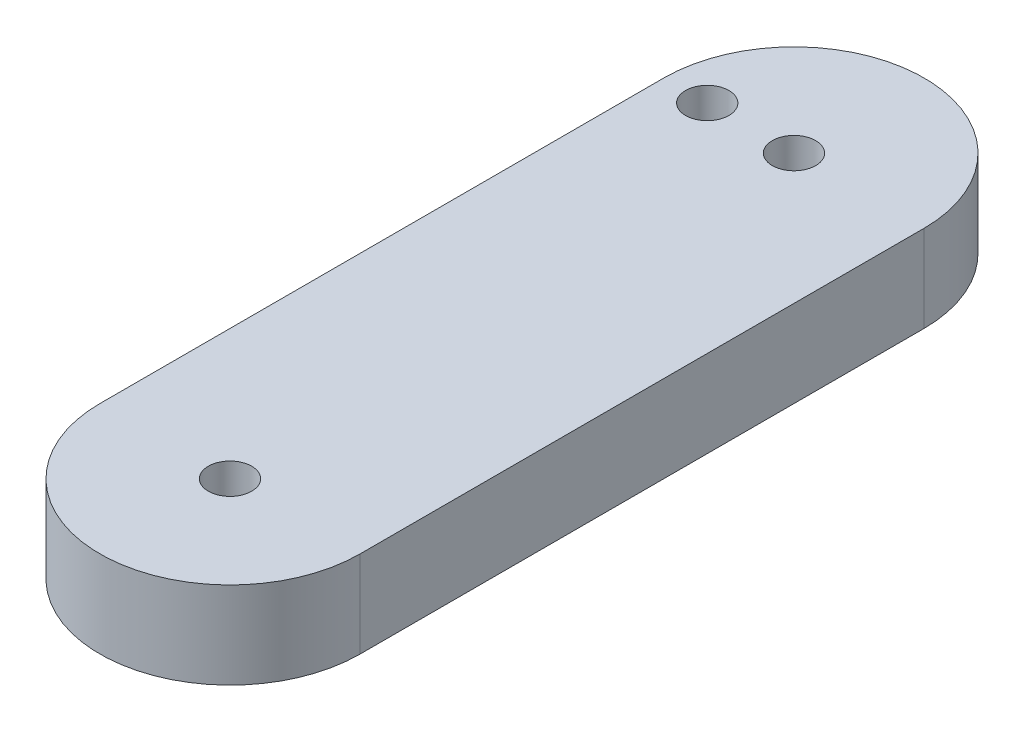
from build123d import *

# Parameters (mm, degrees)
EXTRUDE_1_DEPTH          = 10
CUT_EXTRUDE_1_DEPTH      = 87.02325267
CUT_EXTRUDE_1_DEPTH_BACK = 87.02325267
SKETCH_2_R               = 2.5
SKETCH_4_R               = 2.5
CUT_EXTRUDE_3_DEPTH      = 10


with BuildPart() as part:
    # 草图1 → 凸台-拉伸1 (new body)
    with BuildSketch(Plane(origin=(0, 0, 0), x_dir=(1, 0, 0), z_dir=(0, 1, 0))):
        with BuildLine():
            Line((0, 0), (0, 65))
            ThreePointArc((0, 65), (15, 80), (30, 65))
            Line((30, 65), (30, 0))
            ThreePointArc((30, 0), (15, -15), (0, 0))
        make_face()
    extrude(amount=EXTRUDE_1_DEPTH)

    # 草图2 → 切除-拉伸1 (cut, two sides: drawn at the far end of the back side and taken through both)
    with BuildSketch(Plane(origin=(0, 10, 0), x_dir=(1, 0, 0), z_dir=(0, 1, 0)).offset(-CUT_EXTRUDE_1_DEPTH_BACK)):
        with Locations(Location((15, 65, 0), (0, 0, 270))):
            Circle(SKETCH_2_R)
        with Locations(Location((15, 0, 0), (0, 0, 90))):
            Circle(SKETCH_2_R)
    extrude(amount=CUT_EXTRUDE_1_DEPTH + CUT_EXTRUDE_1_DEPTH_BACK, mode=Mode.SUBTRACT)

    # 草图4 → 切除-拉伸3 (cut)
    with BuildSketch(Plane(origin=(0, 10, 0), x_dir=(1, 0, 0), z_dir=(0, 1, 0))):
        with Locations(Location((5, 65, 0), (0, 0, 270))):
            Circle(SKETCH_4_R)
    extrude(amount=-CUT_EXTRUDE_3_DEPTH, mode=Mode.SUBTRACT)


solid = part.part
